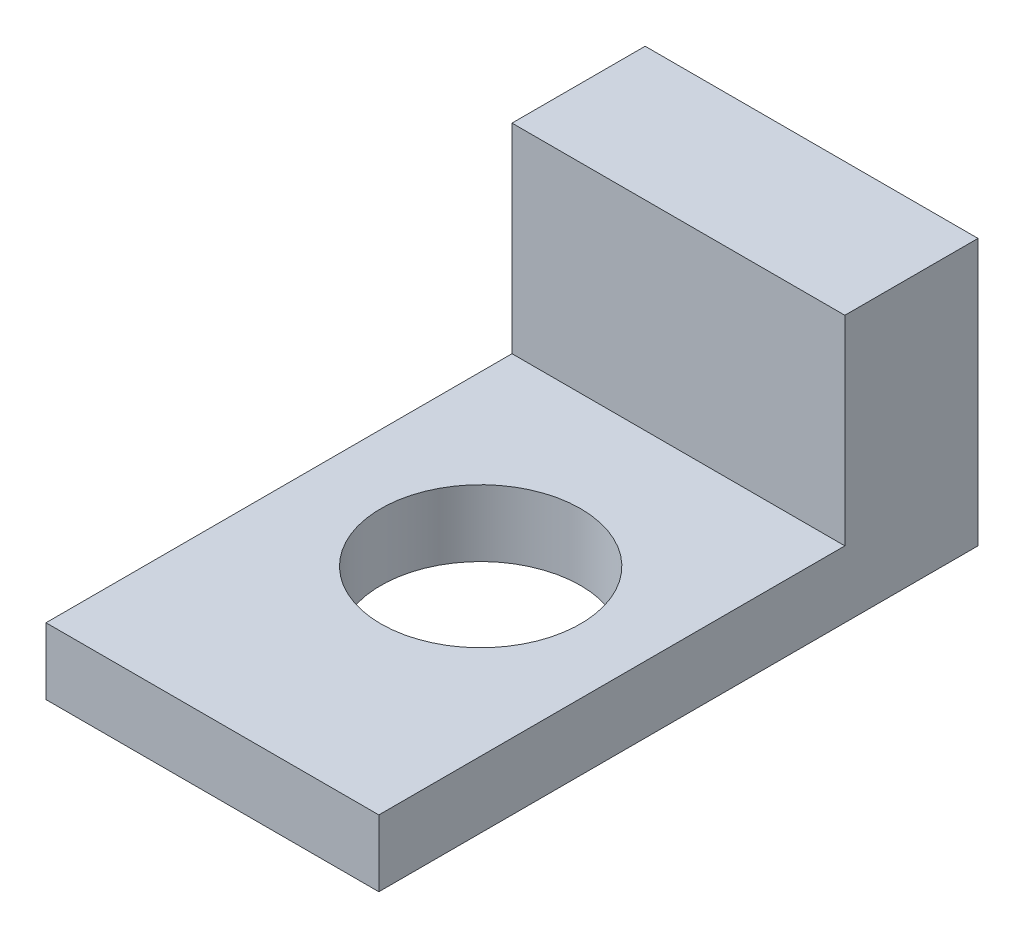
from build123d import *

# Parameters (mm, degrees)
SKETCH1_W           = 50
SKETCH1_H           = 10
BOSS_EXTRUDE1_DEPTH = 90
SKETCH2_W           = 50
SKETCH2_H           = 20
BOSS_EXTRUDE2_DEPTH = 30
SKETCH3_R           = 15.0006
CUT_EXTRUDE1_DEPTH  = 108.238052948


with BuildPart() as part:
    # Sketch1 → Boss-Extrude1 (new body)
    with BuildSketch(Plane.XY):
        with Locations((25, -5)):
            Rectangle(SKETCH1_W, SKETCH1_H)
    extrude(amount=BOSS_EXTRUDE1_DEPTH)

    # Sketch2 → Boss-Extrude2 (add)
    with BuildSketch(Plane(origin=(0, 0, 0), x_dir=(1, 0, 0), z_dir=(0, 1, 0))):
        with Locations((25, -10)):
            Rectangle(SKETCH2_W, SKETCH2_H)
    extrude(amount=BOSS_EXTRUDE2_DEPTH)

    # Sketch3 → Cut-Extrude1 (cut, through all)
    with BuildSketch(Plane(origin=(0, 0, 0), x_dir=(1, 0, 0), z_dir=(0, 1, 0))):
        with Locations(Location((25.294928994, -50, 0), (0, 0, 270))):
            Circle(SKETCH3_R)
    extrude(amount=-CUT_EXTRUDE1_DEPTH, mode=Mode.SUBTRACT)


solid = part.part
